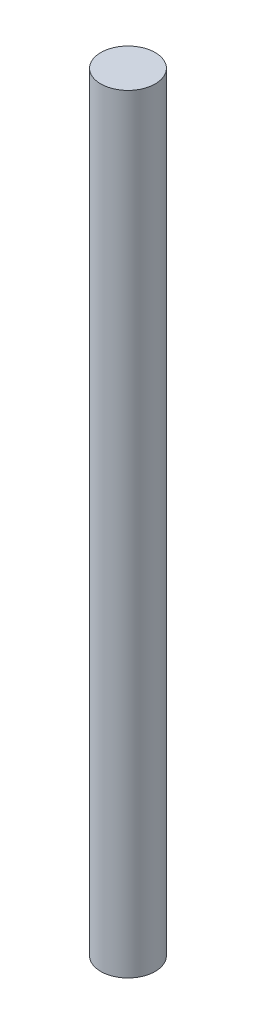
from build123d import *

# Parameters (mm, degrees)
SZKIC1_R                    = 4
DODANIE_WYCI_GNI_CIE1_DEPTH = 113


with BuildPart() as part:
    # Szkic1 → Dodanie-wyciągnięcie1 (new body)
    with BuildSketch(Plane(origin=(0, 0, 0), x_dir=(1, 0, 0), z_dir=(0, 1, 0))):
        with Locations(Location((0, 0, 0), (0, 0, 270))):
            Circle(SZKIC1_R)
    extrude(amount=DODANIE_WYCI_GNI_CIE1_DEPTH)


solid = part.part
